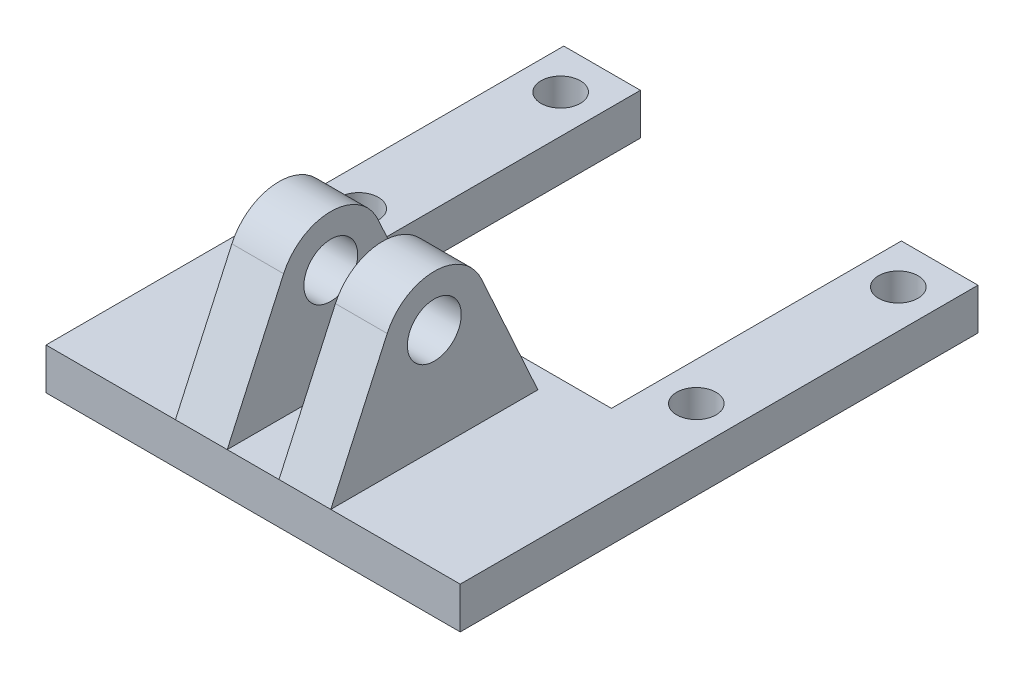
from build123d import *

# Parameters (mm, degrees)
SKETCH1_R           = 1.2065
BOSS_EXTRUDE1_DEPTH = 2.54
SKETCH2_R           = 1.651
BOSS_EXTRUDE2_DEPTH = 4.7625
SKETCH3_W           = 3.175
SKETCH3_H           = 12.7
CUT_EXTRUDE1_DEPTH  = 13.97
FILLET1_R           = 3.175


with BuildPart() as part:
    # Sketch1 → Boss-Extrude1 (new body)
    with BuildSketch(Plane(origin=(0, 0, 0), x_dir=(1, 0, 0), z_dir=(0, 1, 0))):
        Polygon((-12.7, 0), (-12.7, 31.75), (-8.001, 31.75), (-8.001, 13.97), (8.001, 13.97), (8.001, 31.75), (12.7, 31.75), (12.7, 0), align=None)
        with Locations(Location((-10.3505, 29.21, 0), (0, 0, 270))):
            Circle(SKETCH1_R, mode=Mode.SUBTRACT)
        with Locations(Location((-10.3505, 16.8275, 0), (0, 0, 270))):
            Circle(SKETCH1_R, mode=Mode.SUBTRACT)
        with Locations(Location((10.3505, 29.21, 0), (0, 0, 270))):
            Circle(SKETCH1_R, mode=Mode.SUBTRACT)
        with Locations(Location((10.3505, 16.8275, 0), (0, 0, 270))):
            Circle(SKETCH1_R, mode=Mode.SUBTRACT)
    extrude(amount=BOSS_EXTRUDE1_DEPTH)

    # Sketch2 → Boss-Extrude2 (add, symmetric)
    with BuildSketch(Plane(origin=(0, 0, 0), x_dir=(0, 0, -1), z_dir=(1, 0, 0))):
        Polygon((12.7, 2.54), (6.35, 16.51), (0, 2.54), align=None)
        with Locations(Location((6.35, 8.89, 0), (0, 0, 180))):
            Circle(SKETCH2_R, mode=Mode.SUBTRACT)
    extrude(amount=BOSS_EXTRUDE2_DEPTH, both=True)

    # Sketch3 → Cut-Extrude1 (cut)
    with BuildSketch(Plane(origin=(0, 2.54, 0), x_dir=(1, 0, 0), z_dir=(0, 1, 0))):
        with Locations((0, 6.35)):
            Rectangle(SKETCH3_W, SKETCH3_H)
    extrude(amount=CUT_EXTRUDE1_DEPTH, mode=Mode.SUBTRACT)

    # Fillet1
    fillet1_edges = [part.edges().sort_by_distance(p)[0] for p in [
        (3.175, 16.51, -6.35),
        (-3.175, 16.51, -6.35),
    ]]
    fillet(fillet1_edges, radius=FILLET1_R)


solid = part.part
